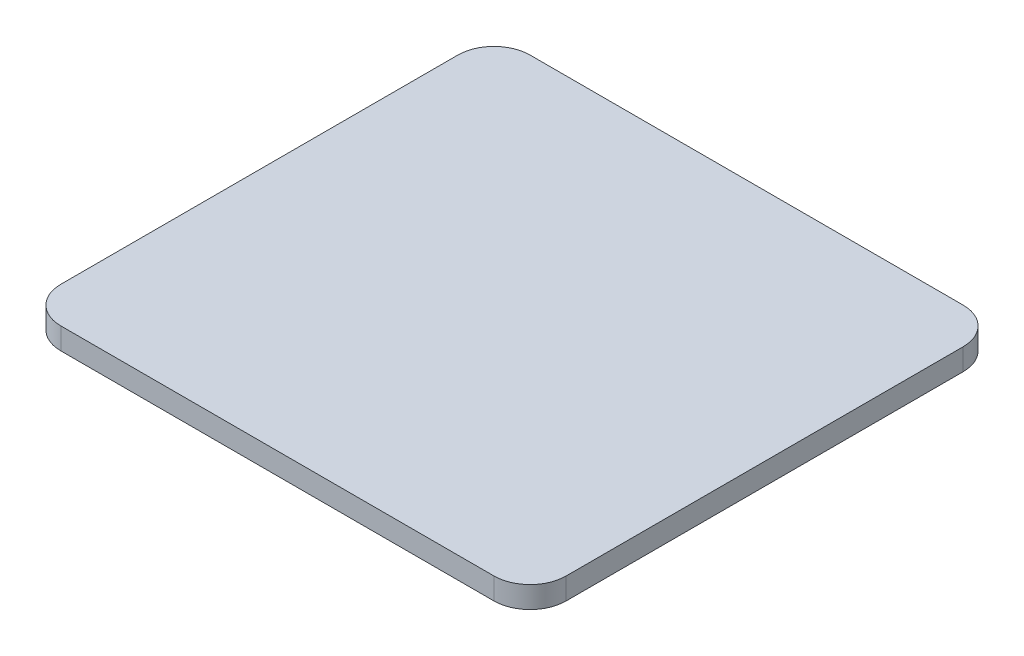
from build123d import *

# Parameters (mm, degrees)
SKETCH1_W           = 70
SKETCH1_H           = 65
BOSS_EXTRUDE1_DEPTH = 3
FILLET1_R           = 5


with BuildPart() as part:
    # Sketch1 → Boss-Extrude1 (new body)
    with BuildSketch(Plane(origin=(0, 0, 0), x_dir=(1, 0, 0), z_dir=(0, 1, 0))):
        Rectangle(SKETCH1_W, SKETCH1_H)
    extrude(amount=BOSS_EXTRUDE1_DEPTH)

    # Fillet1
    fillet1_edges = [part.edges().sort_by_distance(p)[0] for p in [
        (35, 1.5, 32.5),
        (-35, 1.5, 32.5),
        (-35, 1.5, -32.5),
        (35, 1.5, -32.5),
    ]]
    fillet(fillet1_edges, radius=FILLET1_R)


solid = part.part
